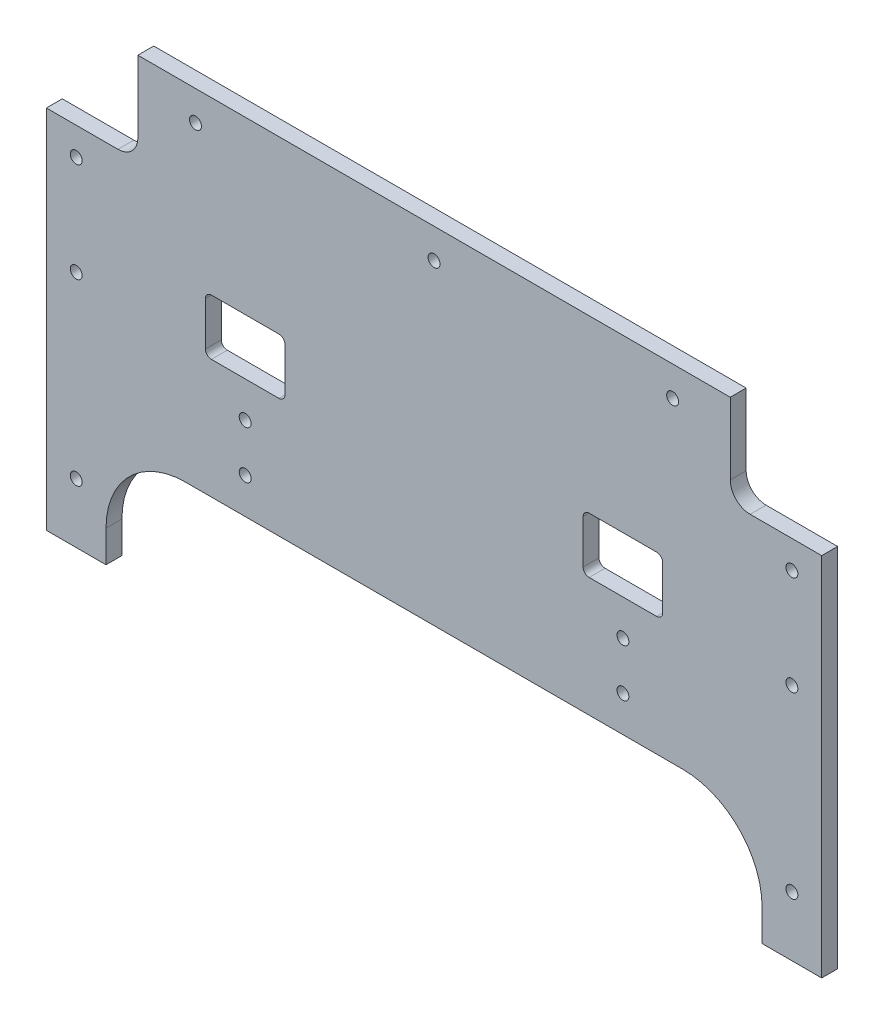
from build123d import *

# Parameters (mm, degrees)
SKETCH_1_W          = 195
SKETCH_1_H          = 50
EXTRUDE_1_DEPTH     = 4
SKETCH_5_W          = 195
SKETCH_5_H          = 50
EXTRUDE_2_DEPTH     = 4
SKETCH_2_R          = 1.5
CUT_EXTRUDE_1_DEPTH = 124.074164633
SKETCH_4_W          = 20
SKETCH_4_H          = 14
CUT_EXTRUDE_3_DEPTH = 124.074164633
FILLET_1_R          = 1.5
SKETCH_6_W          = 23
SKETCH_6_H          = 23
CUT_EXTRUDE_4_DEPTH = 124.074164633
FILLET_2_R          = 5
SKETCH_7_W          = 15
SKETCH_7_H          = 15
EXTRUDE_3_DEPTH     = 4
SKETCH_3_R          = 1.5
CUT_EXTRUDE_2_DEPTH = 124.074164633
SKETCH_8_R          = 1.5
CUT_EXTRUDE_5_DEPTH = 124.074164633
SKETCH_9_W          = 165
SKETCH_9_H          = 13
CUT_EXTRUDE_6_DEPTH = 124.074164633
FILLET_3_R          = 20


with BuildPart() as part:
    # 草图1 → 凸台-拉伸1 (new body)
    with BuildSketch(Plane.XY):
        Rectangle(SKETCH_1_W, SKETCH_1_H)
    extrude(amount=EXTRUDE_1_DEPTH)

    # 草图5 → 凸台-拉伸2 (add)
    with BuildSketch(Plane.XY.offset(4)):
        with Locations((0, 50)):
            Rectangle(SKETCH_5_W, SKETCH_5_H)
    extrude(amount=-EXTRUDE_2_DEPTH)

    # 草图2 → 切除-拉伸1 (cut, through all)
    with BuildSketch(Plane.XY.offset(4)):
        with Locations((-47.5, -3)):
            Circle(SKETCH_2_R)
        with Locations((-47.5, 9)):
            Circle(SKETCH_2_R)
        with Locations((47.5, 9)):
            Circle(SKETCH_2_R)
        with Locations((47.5, -3)):
            Circle(SKETCH_2_R)
    extrude(amount=-CUT_EXTRUDE_1_DEPTH, mode=Mode.SUBTRACT)

    # 草图4 → 切除-拉伸3 (cut, through all)
    with BuildSketch(Plane.XY.offset(4)):
        with Locations((47.5, 25)):
            Rectangle(SKETCH_4_W, SKETCH_4_H)
        with Locations((-47.5, 25)):
            Rectangle(SKETCH_4_W, SKETCH_4_H)
    extrude(amount=-CUT_EXTRUDE_3_DEPTH, mode=Mode.SUBTRACT)

    # 圆角1
    fillet_1_edges = [part.edges().sort_by_distance(p)[0] for p in [
        (37.5, 18, 2),
        (37.5, 32, 2),
        (57.5, 32, 2),
        (57.5, 18, 2),
        (-57.5, 32, 2),
        (-37.5, 32, 2),
        (-37.5, 18, 2),
        (-57.5, 18, 2),
    ]]
    fillet(fillet_1_edges, radius=FILLET_1_R)

    # 草图6 → 切除-拉伸4 (cut, through all)
    with BuildSketch(Plane.XY.offset(4)):
        with Locations((-86, 63.5)):
            Rectangle(SKETCH_6_W, SKETCH_6_H)
        with Locations((86, 63.5)):
            Rectangle(SKETCH_6_W, SKETCH_6_H)
    extrude(amount=-CUT_EXTRUDE_4_DEPTH, mode=Mode.SUBTRACT)

    # 圆角2
    fillet_2_edges = [part.edges().sort_by_distance(p)[0] for p in [
        (-74.5, 52, 2),
        (74.5, 52, 2),
    ]]
    fillet(fillet_2_edges, radius=FILLET_2_R)

    # 草图7 → 凸台-拉伸3 (add)
    with BuildSketch(Plane.XY.offset(4)):
        with Locations((90, -32.5)):
            Rectangle(SKETCH_7_W, SKETCH_7_H)
        with Locations((-90, -32.5)):
            Rectangle(SKETCH_7_W, SKETCH_7_H)
    extrude(amount=-EXTRUDE_3_DEPTH)

    # 草图3 → 切除-拉伸2 (cut, through all)
    with BuildSketch(Plane.XY.offset(4)):
        with Locations((-90, 45)):
            Circle(SKETCH_3_R)
        with Locations((-90, -25)):
            Circle(SKETCH_3_R)
        with Locations((90, -25)):
            Circle(SKETCH_3_R)
        with Locations((90, 45)):
            Circle(SKETCH_3_R)
        with Locations((-90, 20)):
            Circle(SKETCH_3_R)
        with Locations((90, 20)):
            Circle(SKETCH_3_R)
    extrude(amount=-CUT_EXTRUDE_2_DEPTH, mode=Mode.SUBTRACT)

    # 草图8 → 切除-拉伸5 (cut, through all)
    with BuildSketch(Plane.XY.offset(4)):
        with Locations((0, 67.5)):
            Circle(SKETCH_8_R)
        with Locations((-60, 67.5)):
            Circle(SKETCH_8_R)
        with Locations(Location((60, 67.5, 0), (0, 0, 180))):
            Circle(SKETCH_8_R)
    extrude(amount=-CUT_EXTRUDE_5_DEPTH, mode=Mode.SUBTRACT)

    # 草图9 → 切除-拉伸6 (cut, through all)
    with BuildSketch(Plane.XY.offset(4)):
        with Locations((0, -18.5)):
            Rectangle(SKETCH_9_W, SKETCH_9_H)
    extrude(amount=-CUT_EXTRUDE_6_DEPTH, mode=Mode.SUBTRACT)

    # 圆角3
    fillet_3_edges = [part.edges().sort_by_distance(p)[0] for p in [
        (-82.5, -12, 2),
        (82.5, -12, 2),
    ]]
    fillet(fillet_3_edges, radius=FILLET_3_R)


solid = part.part
